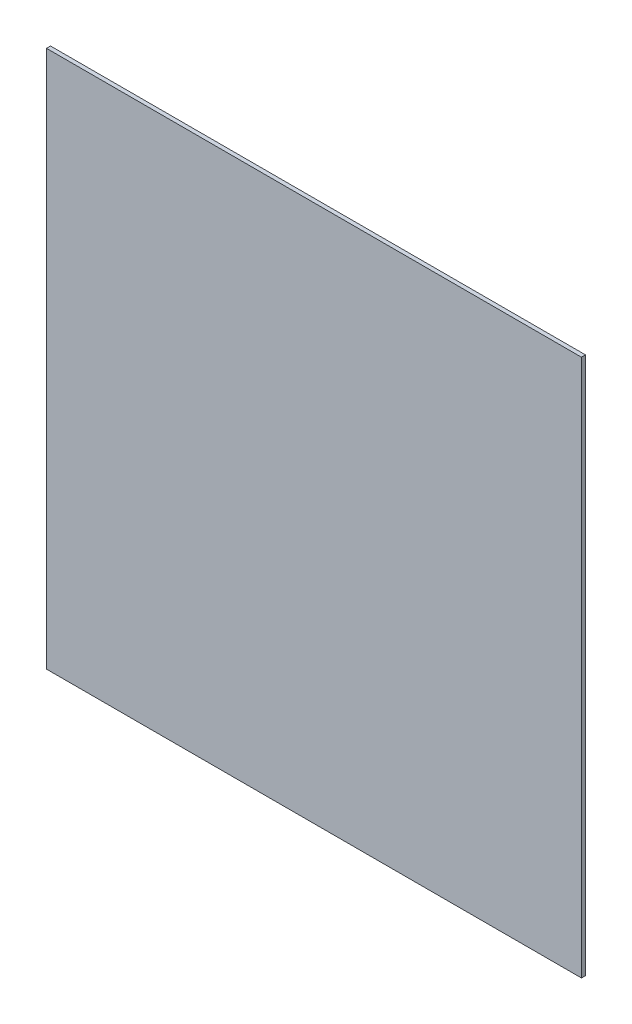
from build123d import *

# Parameters (mm, degrees)
SKETCH_1_W      = 397
SKETCH_1_H      = 399
EXTRUDE_1_DEPTH = 3


with BuildPart() as part:
    # 草圖1 → 填料-伸長1 (new body)
    with BuildSketch(Plane.XY):
        Rectangle(SKETCH_1_W, SKETCH_1_H)
    extrude(amount=EXTRUDE_1_DEPTH)


solid = part.part
